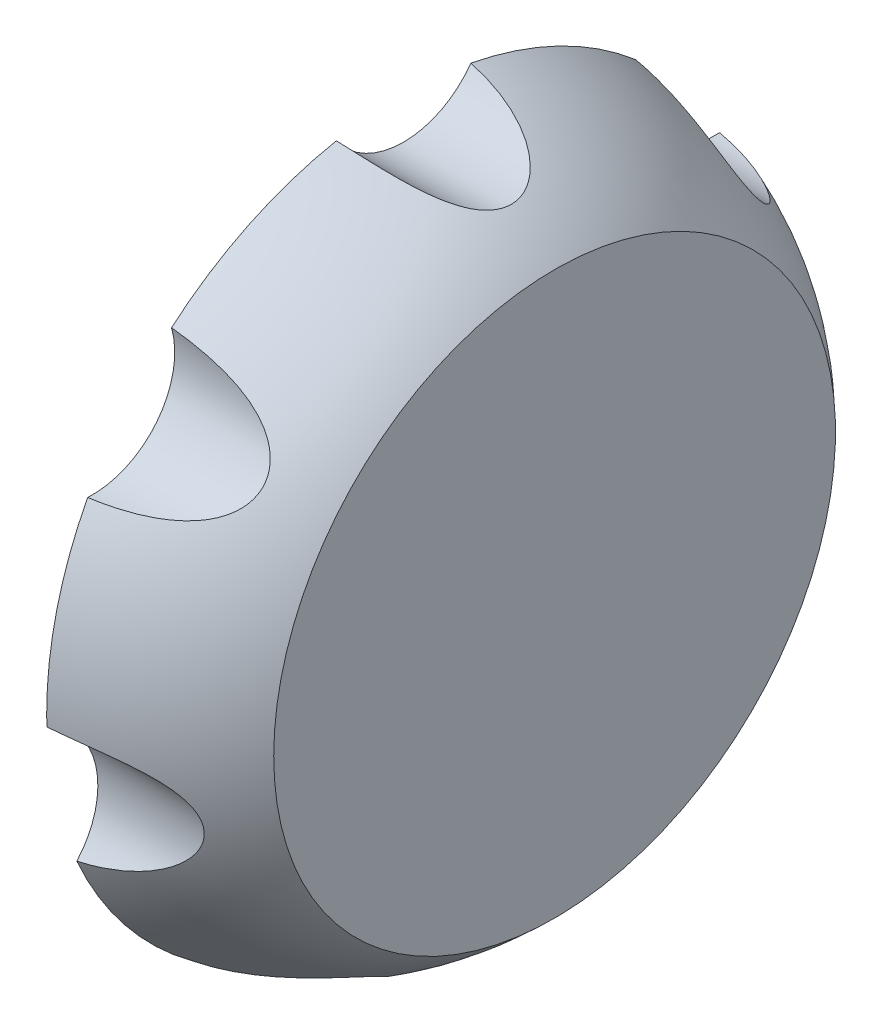
from build123d import *

# Parameters (mm, degrees)
SKETCH3_R          = 38.1
CUT_EXTRUDE1_DEPTH = 69.85


with BuildPart() as part:
    # Sketch1 → Revolve1 (revolve)
    with BuildSketch(Plane.XY, mode=Mode.PRIVATE) as revolve1_sk:
        with BuildLine():
            Line((0, 38.1), (50.8, 38.1))
            Line((50.8, 38.1), (50.8, 0))
            Line((50.8, 0), (69.85, 0))
            Line((69.85, 0), (69.85, 129.934932302))
            ThreePointArc((69.85, 129.934932302), (37.699059438, 153.027708686), (0, 165.1))
            Line((0, 165.1), (0, 38.1))
        make_face()
    revolve(revolve1_sk.sketch.rotate(Axis((50.8, 0, 0), (1, 0, 0)), 90), axis=Axis((50.8, 0, 0), (1, 0, 0)))

    # Sketch3 → Cut-Extrude1 (cut)
    with BuildSketch(Plane(origin=(69.85, 0, 0), x_dir=(0, 0, -1), z_dir=(1, 0, 0))):
        with Locations((0, 184.15)):
            Circle(SKETCH3_R)
        with Locations((143.974267496, 114.815647012)):
            Circle(SKETCH3_R)
        with Locations((179.532975028, -40.977229988)):
            Circle(SKETCH3_R)
        with Locations((79.899690559, -165.913417024)):
            Circle(SKETCH3_R)
        with Locations((-79.899690558, -165.913417024)):
            Circle(SKETCH3_R)
        with Locations((-179.532975028, -40.977229988)):
            Circle(SKETCH3_R)
        with Locations((-143.974267496, 114.815647012)):
            Circle(SKETCH3_R)
    extrude(amount=-CUT_EXTRUDE1_DEPTH, mode=Mode.SUBTRACT)


solid = part.part
